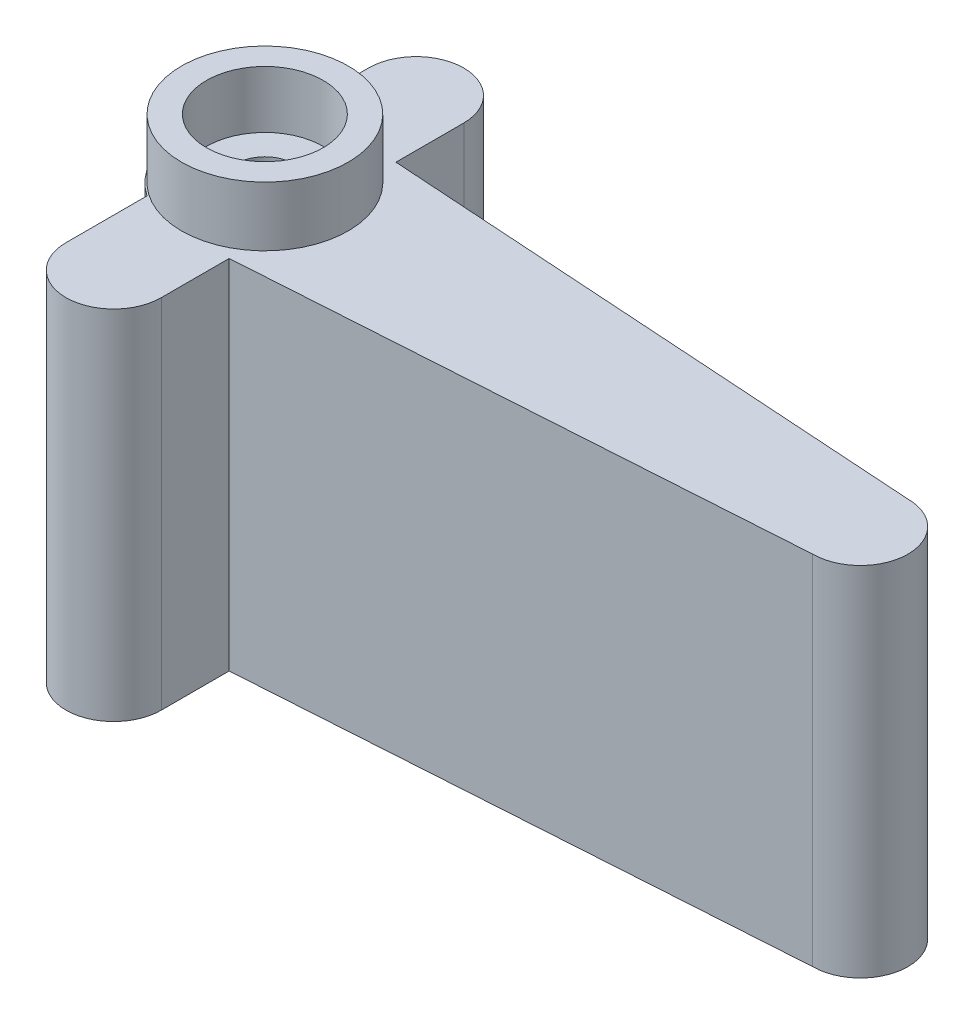
from build123d import *

# Parameters (mm, degrees)
BOSS_EXTRUDE1_DEPTH = 15
SKETCH2_R           = 2.35
CUT_EXTRUDE1_DEPTH  = 1
SKETCH3_R           = 3.5
SKETCH3_R_2         = 2.45
BOSS_EXTRUDE2_DEPTH = 2.5
SKETCH4_R           = 1.2
CUT_EXTRUDE2_DEPTH  = 32.995663769
SKETCH5_R           = 2.45
SKETCH5_R_2         = 1.2
BOSS_EXTRUDE3_DEPTH = 0.1


with BuildPart() as part:
    # Sketch1 → Boss-Extrude1 (new body)
    with BuildSketch(Plane(origin=(0, 0, 0), x_dir=(1, 0, 0), z_dir=(0, 1, 0))):
        with BuildLine():
            Line((2, 6.35), (2, 3.5))
            Line((2, 3.5), (25, 2))
            ThreePointArc((25, 2), (27, 0), (25, -2))
            Line((25, -2), (2, -3.5))
            Line((2, -3.5), (2, -6.35))
            ThreePointArc((2, -6.35), (0, -8.35), (-2, -6.35))
            Line((-2, -6.35), (-2, -2.95))
            ThreePointArc((-2, -2.95), (-3.564056677, 0), (-2, 2.95))
            Line((-2, 2.95), (-2, 6.35))
            ThreePointArc((-2, 6.35), (0, 8.35), (2, 6.35))
        make_face()
    extrude(amount=BOSS_EXTRUDE1_DEPTH)

    # Sketch2 → Cut-Extrude1 (cut)
    with BuildSketch(Plane.XZ):
        with Locations(Location((0, 0, 0), (0, 0, 270))):
            Circle(SKETCH2_R)
    extrude(amount=-CUT_EXTRUDE1_DEPTH, mode=Mode.SUBTRACT)

    # Sketch3 → Boss-Extrude2 (add)
    with BuildSketch(Plane(origin=(0, 15, 0), x_dir=(1, 0, 0), z_dir=(0, 1, 0))):
        with Locations(Location((0, 0, 0), (0, 0, 270))):
            Circle(SKETCH3_R)
        with Locations(Location((0, 0, 0), (0, 0, 270))):
            Circle(SKETCH3_R_2, mode=Mode.SUBTRACT)
    extrude(amount=BOSS_EXTRUDE2_DEPTH)

    # Sketch4 → Cut-Extrude2 (cut, through all)
    with BuildSketch(Plane(origin=(0, 15, 0), x_dir=(1, 0, 0), z_dir=(0, 1, 0))):
        with Locations(Location((0, 0, 0), (0, 0, 270))):
            Circle(SKETCH4_R)
    extrude(amount=-CUT_EXTRUDE2_DEPTH, mode=Mode.SUBTRACT)

    # Sketch5 → Boss-Extrude3 (add)
    with BuildSketch(Plane(origin=(0, 15, 0), x_dir=(1, 0, 0), z_dir=(0, 1, 0))):
        with Locations(Location((0, 0, 0), (0, 0, 270))):
            Circle(SKETCH5_R)
        with Locations(Location((0, 0, 0), (0, 0, 270))):
            Circle(SKETCH5_R_2, mode=Mode.SUBTRACT)
    extrude(amount=BOSS_EXTRUDE3_DEPTH)


solid = part.part
